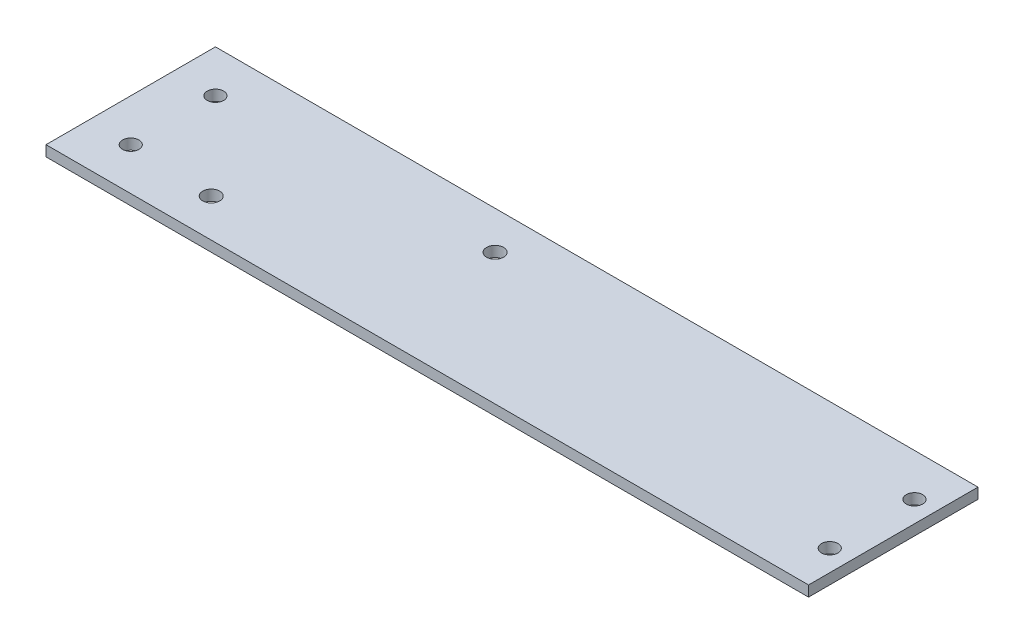
from build123d import *

# Parameters (mm, degrees)
SKETCH1_W                    = 228.6
SKETCH1_H                    = 50.8
BOSS_EXTRUDE1_DEPTH          = 3.175
F_10_0_1935_DIAMETER_HOLE1_D = 4.9149
F_1_4_20_TAPPED_HOLE1_D      = 5.1054


with BuildPart() as part:
    # Sketch1 → Boss-Extrude1 (new body)
    with BuildSketch(Plane(origin=(0, 0, 0), x_dir=(1, 0, 0), z_dir=(0, 1, 0))):
        Rectangle(SKETCH1_W, SKETCH1_H)
    extrude(amount=BOSS_EXTRUDE1_DEPTH)

    # #10 (0.1935) Diameter Hole1 (through all)
    with Locations(Plane(origin=(0, 3.175, 0), x_dir=(1, 0, 0), z_dir=(0, 1, 0))):
        with Locations((107.95, 12.7), (-101.6, -12.7), (-101.6, 12.7), (107.95, -12.7)):
            Hole(F_10_0_1935_DIAMETER_HOLE1_D / 2)

    # 1/4-20 Tapped Hole1 (through all)
    with Locations(Plane(origin=(0, 3.175, 0), x_dir=(1, 0, 0), z_dir=(0, 1, 0))):
        with Locations((-76.2, -13.97), (-19.05, 13.97)):
            Hole(F_1_4_20_TAPPED_HOLE1_D / 2)


solid = part.part
